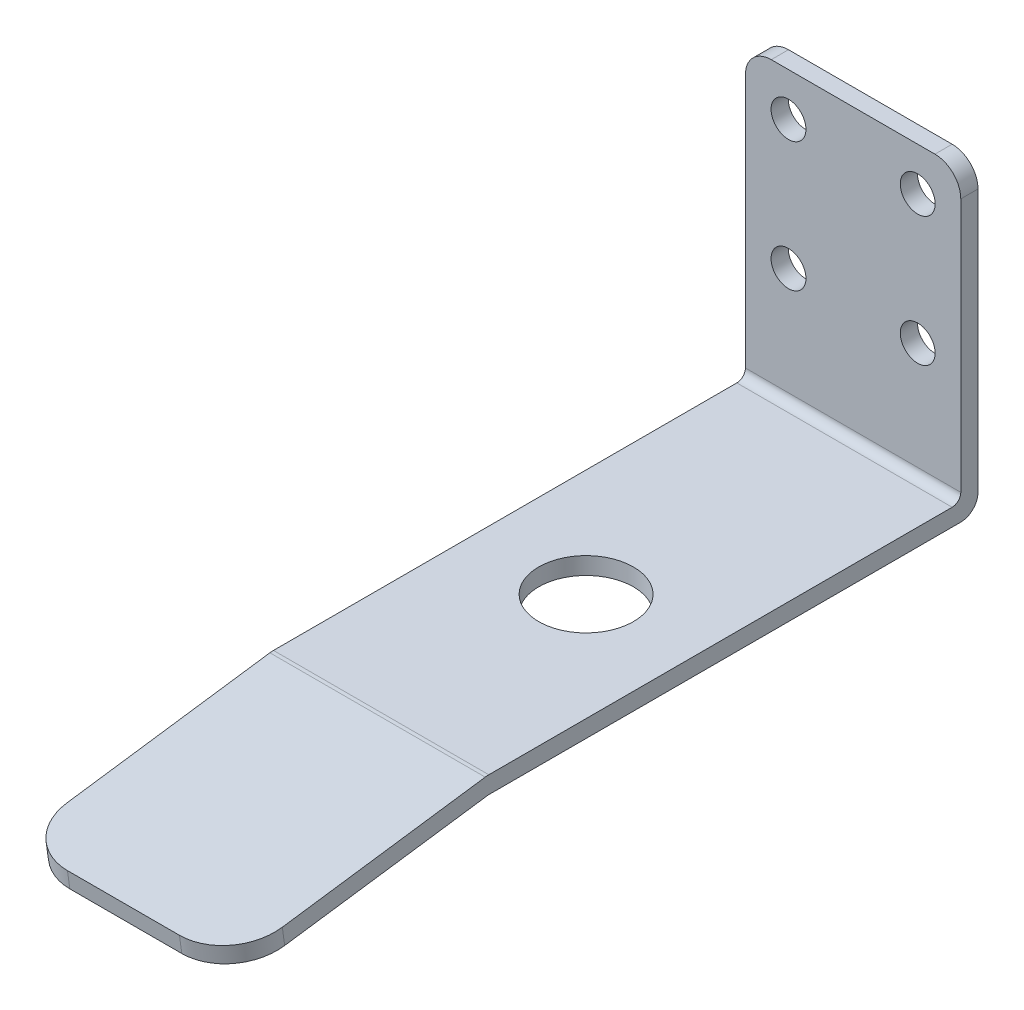
from build123d import *

# Parameters (mm, degrees)
SKETCH1_W           = 25
SKETCH1_H           = 25
SKETCH1_R           = 2.025
BOSS_EXTRUDE1_DEPTH = 2
SKETCH2_W           = 25
SKETCH2_H           = 2
BOSS_EXTRUDE2_DEPTH = 10.5
SKETCH3_W           = 25
SKETCH3_H           = 2
BOSS_EXTRUDE3_DEPTH = 55
FILLET1_R           = 3
FILLET2_R           = 2
FILLET3_R           = 1
BOSS_EXTRUDE4_DEPTH = 25
FILLET4_R           = 3
FILLET5_R           = 2
SKETCH6_R           = 5.5
CUT_EXTRUDE1_DEPTH  = 95.523989327
FILLET6_R           = 6


with BuildPart() as part:
    # Sketch1 → Boss-Extrude1 (new body)
    with BuildSketch(Plane.XY):
        Rectangle(SKETCH1_W, SKETCH1_H)
        with Locations((-7.5, 7.5)):
            Circle(SKETCH1_R, mode=Mode.SUBTRACT)
        with Locations((7.5, 7.5)):
            Circle(SKETCH1_R, mode=Mode.SUBTRACT)
        with Locations((7.5, -7.5)):
            Circle(SKETCH1_R, mode=Mode.SUBTRACT)
        with Locations((-7.5, -7.5)):
            Circle(SKETCH1_R, mode=Mode.SUBTRACT)
    extrude(amount=BOSS_EXTRUDE1_DEPTH)

    # Sketch2 → Boss-Extrude2 (add)
    with BuildSketch(Plane.XZ.offset(12.5)):
        with Locations((0, 1)):
            Rectangle(SKETCH2_W, SKETCH2_H)
    extrude(amount=BOSS_EXTRUDE2_DEPTH)

    # Sketch3 → Boss-Extrude3 (add)
    with BuildSketch(Plane.XY.offset(2)):
        with Locations((0, -22)):
            Rectangle(SKETCH3_W, SKETCH3_H)
    extrude(amount=BOSS_EXTRUDE3_DEPTH)

    # Fillet1
    fillet1_edges = [part.edges().sort_by_distance(p)[0] for p in [
        (-12.5, 12.5, 1),
        (12.5, 12.5, 1),
    ]]
    fillet(fillet1_edges, radius=FILLET1_R)

    # Fillet2
    fillet2_edges = [part.edges().sort_by_distance(p)[0] for p in [
        (0, -23, 0),
    ]]
    fillet(fillet2_edges, radius=FILLET2_R)

    # Fillet3
    fillet3_edges = [part.edges().sort_by_distance(p)[0] for p in [
        (0, -21, 2),
    ]]
    fillet(fillet3_edges, radius=FILLET3_R)

    # Sketch5 → Boss-Extrude4 (add)
    with BuildSketch(Plane.ZY.offset(12.5)):
        Polygon((57, -21), (86.708042062, -25.175193029), (86.42969586, -27.155729166), (57, -23.019655145), (56.721653798, -22.980536137), align=None)
    extrude(amount=-BOSS_EXTRUDE4_DEPTH)

    # Fillet4
    fillet4_edges = [part.edges().sort_by_distance(p)[0] for p in [
        (0, -21, 57),
    ]]
    fillet(fillet4_edges, radius=FILLET4_R)

    # Fillet5
    fillet5_edges = [part.edges().sort_by_distance(p)[0] for p in [
        (0, -23, 56.860146376),
    ]]
    fillet(fillet5_edges, radius=FILLET5_R)

    # Sketch6 → Cut-Extrude1 (cut, through all)
    with BuildSketch(Plane.XZ.offset(23)):
        with Locations(Location((0, 33, 0), (0, 0, 270))):
            Circle(SKETCH6_R)
    extrude(amount=-CUT_EXTRUDE1_DEPTH, mode=Mode.SUBTRACT)

    # Fillet6
    fillet6_edges = [part.edges().sort_by_distance(p)[0] for p in [
        (12.5, -26.165461098, 86.568868961),
        (-12.5, -26.165461098, 86.568868961),
    ]]
    fillet(fillet6_edges, radius=FILLET6_R)


solid = part.part
